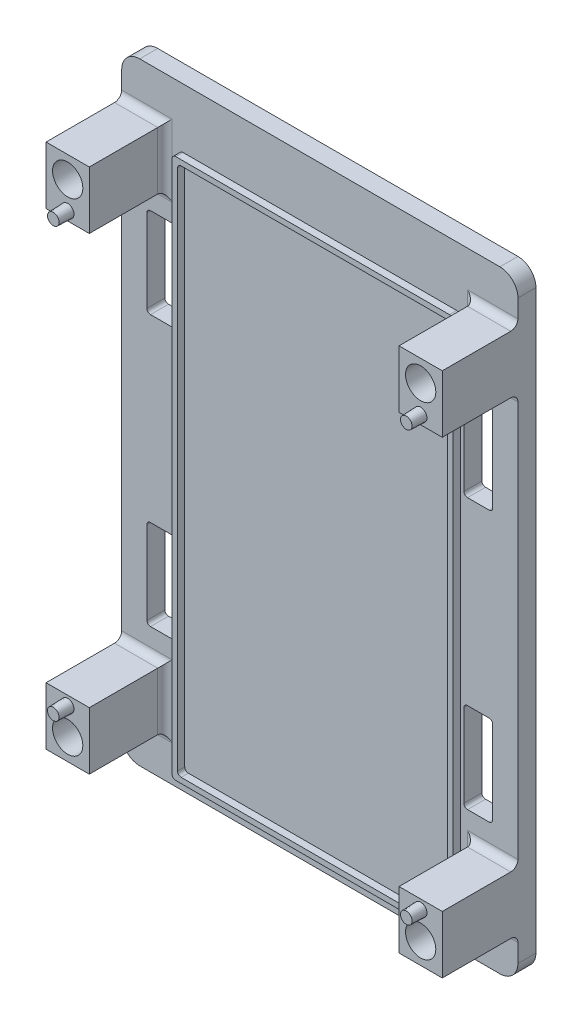
from build123d import *

# Parameters (mm, degrees)
SKIZZE1_W                                 = 110
SKIZZE1_H                                 = 170
AUFSATZ_LINEAR_AUSTRAGEN1_DEPTH           = 5
VERRUNDUNG1_R                             = 5
SKIZZE7_W                                 = 12
SKIZZE7_H                                 = 16
AUFSATZ_LINEAR_AUSTRAGEN3_DEPTH           = 21
VERRUNDUNG2_R                             = 2
SKIZZE8_R                                 = 4.2
SCHNITT_LINEAR_AUSTRAGEN3_DEPTH           = 105.527508341
LINEARES_MUSTER1_COUNT                    = 2
LINEARES_MUSTER1_PITCH                    = 134
LINEARES_MUSTER1_COUNT_DIR2               = 2
LINEARES_MUSTER1_PITCH_DIR2               = 98
SKIZZE11_W                                = 78
SKIZZE11_H                                = 150
SKIZZE11_W_2                              = 75
SKIZZE11_H_2                              = 147
AUFSATZ_LINEAR_AUSTRAGEN4_DEPTH           = 2
VERRUNDUNG3_R                             = 1
SKIZZE12_W                                = 8
SKIZZE12_H                                = 25
SCHNITT_LINEAR_AUSTRAGEN4_DEPTH           = 104.397292034
SKIZZE13_R                                = 1.75
AUFSATZ_LINEAR_AUSTRAGEN5_DEPTH           = 4
AUFSATZ_LINEAR_AUSTRAGEN5_DRAFT           = 2
AUFSATZ_LINEAR_AUSTRAGEN5_PROFILE_2_DEPTH = 4
AUFSATZ_LINEAR_AUSTRAGEN5_PROFILE_2_DRAFT = 2
AUFSATZ_LINEAR_AUSTRAGEN5_PROFILE_3_DEPTH = 4
AUFSATZ_LINEAR_AUSTRAGEN5_PROFILE_3_DRAFT = 2
AUFSATZ_LINEAR_AUSTRAGEN5_PROFILE_4_DEPTH = 4
AUFSATZ_LINEAR_AUSTRAGEN5_PROFILE_4_DRAFT = 2
SKIZZE14_R                                = 2
SCHNITT_LINEAR_AUSTRAGEN5_DEPTH           = 4.5
VERRUNDUNG4_R                             = 1


with BuildPart() as part:
    # Skizze1 → Aufsatz-Linear austragen1 (new body)
    with BuildSketch(Plane.XY):
        Rectangle(SKIZZE1_W, SKIZZE1_H)
    extrude(amount=AUFSATZ_LINEAR_AUSTRAGEN1_DEPTH)

    # Verrundung1
    verrundung1_edges = [part.edges().sort_by_distance(p)[0] for p in [
        (55, -85, 2.5),
        (-55, -85, 2.5),
        (-55, 85, 2.5),
        (55, 85, 2.5),
    ]]
    fillet(verrundung1_edges, radius=VERRUNDUNG1_R)

    # Skizze7 → Aufsatz-Linear austragen3 (add)
    with BuildSketch(Plane.XY.offset(5)):
        with Locations((-49, 65)):
            Rectangle(SKIZZE7_W, SKIZZE7_H)
        with Locations((49, 65)):
            Rectangle(SKIZZE7_W, SKIZZE7_H)
        with Locations((49, -65)):
            Rectangle(SKIZZE7_W, SKIZZE7_H)
        with Locations((-49, -65)):
            Rectangle(SKIZZE7_W, SKIZZE7_H)
    extrude(amount=AUFSATZ_LINEAR_AUSTRAGEN3_DEPTH)

    # Verrundung2
    verrundung2_edges = [part.edges().sort_by_distance(p)[0] for p in [
        (-49, 57, 5),
        (-43, 65, 5),
        (-49, 73, 5),
        (49, 73, 5),
        (43, 65, 5),
        (49, 57, 5),
        (49, -57, 5),
        (43, -65, 5),
        (49, -73, 5),
        (-49, -73, 5),
        (-43, -65, 5),
        (-49, -57, 5),
    ]]
    fillet(verrundung2_edges, radius=VERRUNDUNG2_R)

    # Skizze8 → Schnitt-Linear austragen3 (cut, through all)
    with BuildSketch(Plane.XY.offset(26)):
        with Locations((-49, 67)):
            Circle(SKIZZE8_R)
    schnitt_linear_austragen3 = extrude(amount=-SCHNITT_LINEAR_AUSTRAGEN3_DEPTH, mode=Mode.SUBTRACT)

    # Lineares Muster1: Schnitt-Linear austragen3 2 × 2
    with Locations(*[(j * LINEARES_MUSTER1_PITCH_DIR2, -i * LINEARES_MUSTER1_PITCH, 0) for i in range(LINEARES_MUSTER1_COUNT) for j in range(LINEARES_MUSTER1_COUNT_DIR2) if (i, j) != (0, 0)]):
        add(schnitt_linear_austragen3, mode=Mode.SUBTRACT)

    # Skizze11 → Aufsatz-Linear austragen4 (add)
    with BuildSketch(Plane.XY.offset(5)):
        with Locations((0, -6.5)):
            Rectangle(SKIZZE11_W, SKIZZE11_H)
        with Locations((0, -6.5)):
            Rectangle(SKIZZE11_W_2, SKIZZE11_H_2, mode=Mode.SUBTRACT)
    extrude(amount=AUFSATZ_LINEAR_AUSTRAGEN4_DEPTH)

    # Verrundung3
    verrundung3_edges = [part.edges().sort_by_distance(p)[0] for p in [
        (39, -81.5, 6),
        (39, 68.5, 6),
        (-39, 68.5, 6),
        (-39, -81.5, 6),
        (37.5, 67, 6),
        (-37.5, 67, 6),
        (-37.5, -80, 6),
        (37.5, -80, 6),
    ]]
    fillet(verrundung3_edges, radius=VERRUNDUNG3_R)

    # Skizze12 → Schnitt-Linear austragen4 (cut, through all)
    with BuildSketch(Plane.XY.offset(5)):
        with Locations((-44, 37.5)):
            Rectangle(SKIZZE12_W, SKIZZE12_H)
        with Locations((44, 37.5)):
            Rectangle(SKIZZE12_W, SKIZZE12_H)
        with Locations((44, -37.5)):
            Rectangle(SKIZZE12_W, SKIZZE12_H)
        with Locations((-44, -37.5)):
            Rectangle(SKIZZE12_W, SKIZZE12_H)
    extrude(amount=-SCHNITT_LINEAR_AUSTRAGEN4_DEPTH, mode=Mode.SUBTRACT)


with BuildPart() as aufsatz_linear_austragen5_tool:
    # Skizze13 → Aufsatz-Linear austragen5 (with draft: the straight prism first)
    with BuildSketch(Plane.XY.offset(26)):
        with Locations((-49, 59.5)):
            Circle(SKIZZE13_R)
    extrude(amount=AUFSATZ_LINEAR_AUSTRAGEN5_DEPTH)
    # Aufsatz-Linear austragen5: the draft: its side faces are tilted about the plane it starts from
    aufsatz_linear_austragen5_sides = [aufsatz_linear_austragen5_tool.faces().sort_by_distance(p)[0] for p in [
        (-50.75, 59.5, 28),
    ]]
    draft(aufsatz_linear_austragen5_sides, Plane.XY.offset(26), AUFSATZ_LINEAR_AUSTRAGEN5_DRAFT)


with BuildPart() as part_1:
    add(part.part)

    # Aufsatz-Linear austragen5: add aufsatz_linear_austragen5_tool
    add(aufsatz_linear_austragen5_tool.part)


with BuildPart() as aufsatz_linear_austragen5_profile_2_tool:
    # Skizze13 → Aufsatz-Linear austragen5 profile 2 (with draft: the straight prism first)
    with BuildSketch(Plane.XY.offset(26)):
        with Locations((49, 59.5)):
            Circle(SKIZZE13_R)
    extrude(amount=AUFSATZ_LINEAR_AUSTRAGEN5_PROFILE_2_DEPTH)
    # Aufsatz-Linear austragen5 profile 2: the draft: its side faces are tilted about the plane it starts from
    aufsatz_linear_austragen5_profile_2_sides = [aufsatz_linear_austragen5_profile_2_tool.faces().sort_by_distance(p)[0] for p in [
        (47.25, 59.5, 28),
    ]]
    draft(aufsatz_linear_austragen5_profile_2_sides, Plane.XY.offset(26), AUFSATZ_LINEAR_AUSTRAGEN5_PROFILE_2_DRAFT)


with BuildPart() as part_2:
    add(part_1.part)

    # Aufsatz-Linear austragen5 profile 2: add aufsatz_linear_austragen5_profile_2_tool
    add(aufsatz_linear_austragen5_profile_2_tool.part)


with BuildPart() as aufsatz_linear_austragen5_profile_3_tool:
    # Skizze13 → Aufsatz-Linear austragen5 profile 3 (with draft: the straight prism first)
    with BuildSketch(Plane.XY.offset(26)):
        with Locations((49, -59.5)):
            Circle(SKIZZE13_R)
    extrude(amount=AUFSATZ_LINEAR_AUSTRAGEN5_PROFILE_3_DEPTH)
    # Aufsatz-Linear austragen5 profile 3: the draft: its side faces are tilted about the plane it starts from
    aufsatz_linear_austragen5_profile_3_sides = [aufsatz_linear_austragen5_profile_3_tool.faces().sort_by_distance(p)[0] for p in [
        (47.25, -59.5, 28),
    ]]
    draft(aufsatz_linear_austragen5_profile_3_sides, Plane.XY.offset(26), AUFSATZ_LINEAR_AUSTRAGEN5_PROFILE_3_DRAFT)


with BuildPart() as part_3:
    add(part_2.part)

    # Aufsatz-Linear austragen5 profile 3: add aufsatz_linear_austragen5_profile_3_tool
    add(aufsatz_linear_austragen5_profile_3_tool.part)


with BuildPart() as aufsatz_linear_austragen5_profile_4_tool:
    # Skizze13 → Aufsatz-Linear austragen5 profile 4 (with draft: the straight prism first)
    with BuildSketch(Plane.XY.offset(26)):
        with Locations((-49, -59.5)):
            Circle(SKIZZE13_R)
    extrude(amount=AUFSATZ_LINEAR_AUSTRAGEN5_PROFILE_4_DEPTH)
    # Aufsatz-Linear austragen5 profile 4: the draft: its side faces are tilted about the plane it starts from
    aufsatz_linear_austragen5_profile_4_sides = [aufsatz_linear_austragen5_profile_4_tool.faces().sort_by_distance(p)[0] for p in [
        (-50.75, -59.5, 28),
    ]]
    draft(aufsatz_linear_austragen5_profile_4_sides, Plane.XY.offset(26), AUFSATZ_LINEAR_AUSTRAGEN5_PROFILE_4_DRAFT)


with BuildPart() as part_4:
    add(part_3.part)

    # Aufsatz-Linear austragen5 profile 4: add aufsatz_linear_austragen5_profile_4_tool
    add(aufsatz_linear_austragen5_profile_4_tool.part)

    # Skizze14 → Schnitt-Linear austragen5 (cut)
    with BuildSketch(Plane(origin=(0, 0, 0), x_dir=(-1, 0, 0), z_dir=(0, 0, -1))):
        with Locations((49, 59.5)):
            Circle(SKIZZE14_R)
        with Locations(Location((-49, 59.5, 0), (0, 0, 180))):
            Circle(SKIZZE14_R)
        with Locations((-49, -59.5)):
            Circle(SKIZZE14_R)
        with Locations(Location((49, -59.5, 0), (0, 0, 180))):
            Circle(SKIZZE14_R)
    extrude(amount=-SCHNITT_LINEAR_AUSTRAGEN5_DEPTH, mode=Mode.SUBTRACT)

    # Verrundung4
    verrundung4_edges = [part_4.edges().sort_by_distance(p)[0] for p in [
        (-48, -50, 2.5),
        (-48, -25, 2.5),
        (-40, -25, 2.5),
        (-40, -50, 2.5),
        (40, -25, 2.5),
        (48, -25, 2.5),
        (48, -50, 2.5),
        (40, -50, 2.5),
        (48, 50, 2.5),
        (48, 25, 2.5),
        (40, 25, 2.5),
        (40, 50, 2.5),
        (-40, 50, 2.5),
        (-40, 25, 2.5),
        (-48, 25, 2.5),
        (-48, 50, 2.5),
    ]]
    fillet(verrundung4_edges, radius=VERRUNDUNG4_R)


solid = part_4.part
